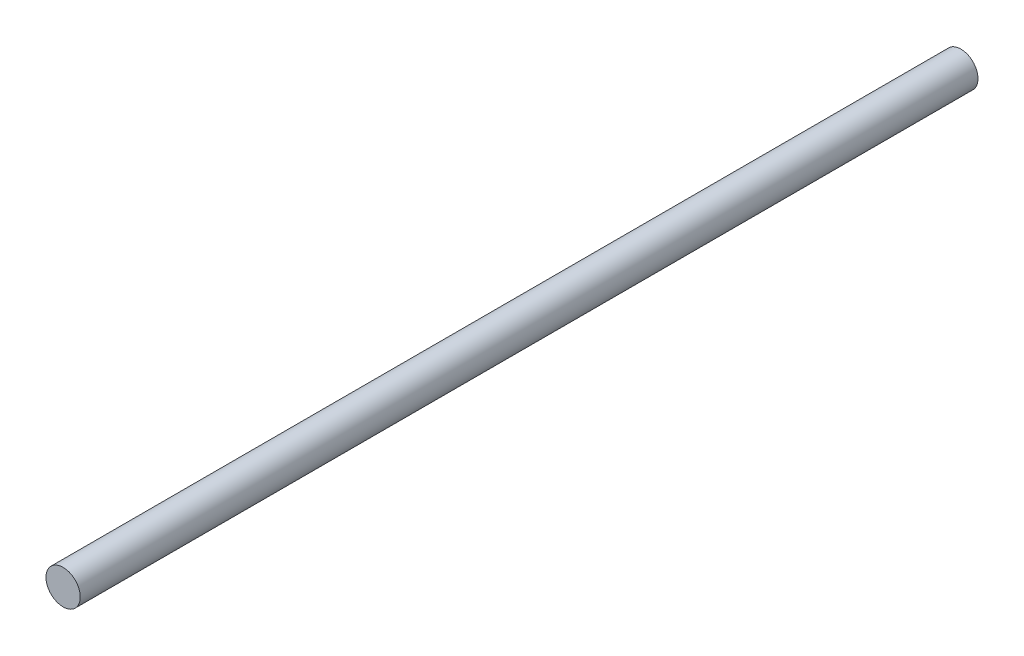
from build123d import *

# Parameters (mm, degrees)
CROQUIS1_R              = 0.63
SALIENTE_EXTRUIR1_DEPTH = 33


with BuildPart() as part:
    # Croquis1 → Saliente-Extruir1 (new body)
    with BuildSketch(Plane.XY):
        Circle(CROQUIS1_R)
    extrude(amount=SALIENTE_EXTRUIR1_DEPTH)


solid = part.part
